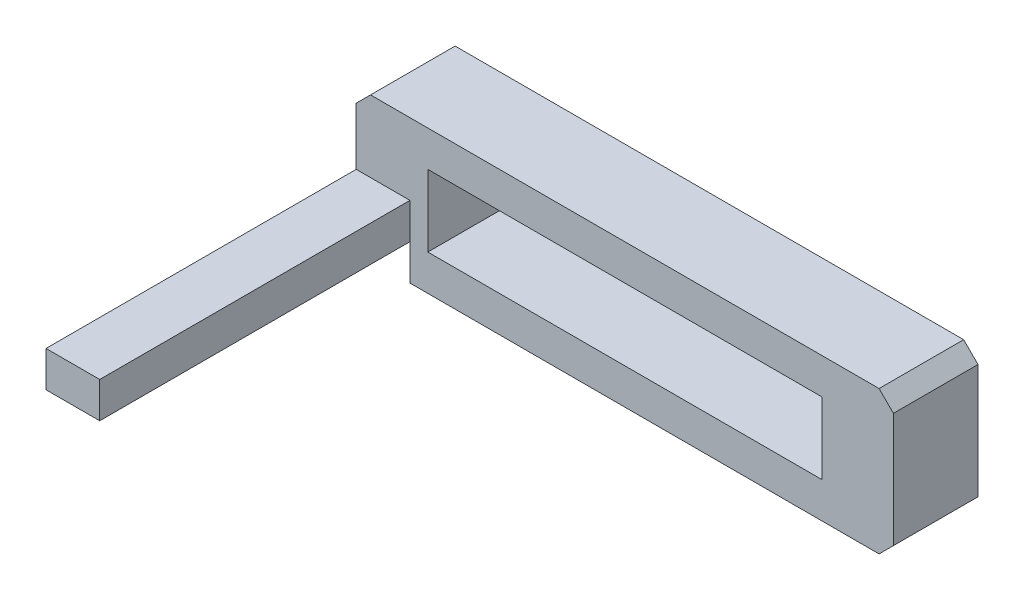
from build123d import *

# Parameters (mm, degrees)
SKETCH1_W           = 95.25
SKETCH1_H           = 25.4
SKETCH1_W_2         = 69.85
SKETCH1_H_2         = 12.7
BOSS_EXTRUDE1_DEPTH = 15
SKETCH2_W           = 9.525
SKETCH2_H           = 6.35
BOSS_EXTRUDE2_DEPTH = 55
CHAMFER1_SIZE       = 2.54
SKETCH4_W           = 9.525
SKETCH4_H           = 6.35
CUT_EXTRUDE2_DEPTH  = 113.883667995


with BuildPart() as part:
    # Sketch1 → Boss-Extrude1 (new body)
    with BuildSketch(Plane.XY):
        with Locations((-47.625, 12.7)):
            Rectangle(SKETCH1_W, SKETCH1_H)
        with Locations((-47.625, 12.7)):
            Rectangle(SKETCH1_W_2, SKETCH1_H_2, mode=Mode.SUBTRACT)
    extrude(amount=BOSS_EXTRUDE1_DEPTH)

    # Sketch2 → Boss-Extrude2 (add)
    with BuildSketch(Plane.XY.offset(15)):
        with Locations((-90.4875, 9.525)):
            Rectangle(SKETCH2_W, SKETCH2_H)
    extrude(amount=BOSS_EXTRUDE2_DEPTH)

    # Chamfer1
    chamfer1_edges = [part.edges().sort_by_distance(p)[0] for p in [
        (-95.25, 25.4, 7.5),
        (0, 25.4, 7.5),
        (0, 0, 7.5),
        (-95.25, 0, 7.5),
    ]]
    chamfer(chamfer1_edges, length=CHAMFER1_SIZE)

    # Sketch4 → Cut-Extrude2 (cut, through all)
    with BuildSketch(Plane.XY.offset(15)):
        with Locations((-90.4875, 3.175)):
            Rectangle(SKETCH4_W, SKETCH4_H)
    extrude(amount=-CUT_EXTRUDE2_DEPTH, mode=Mode.SUBTRACT)


solid = part.part
